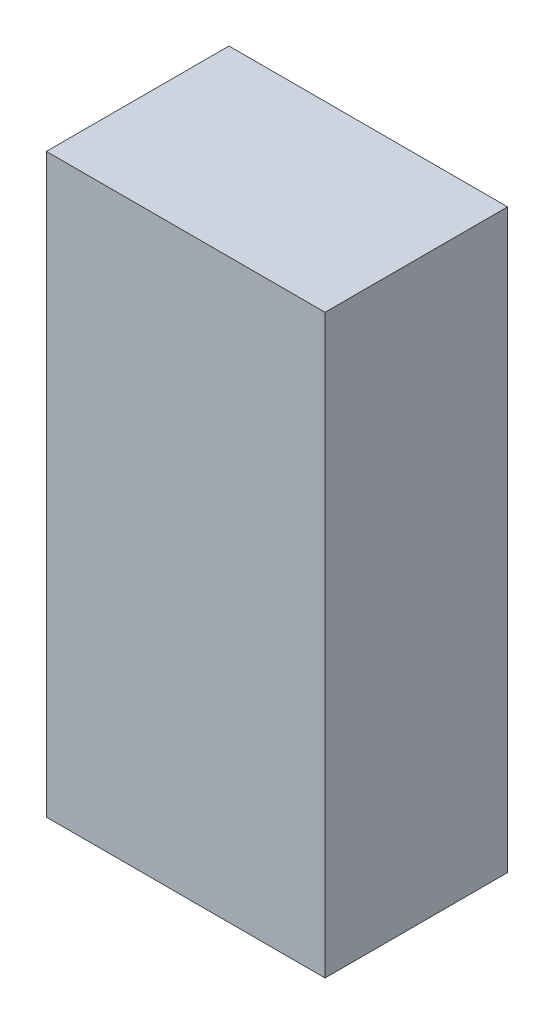
from build123d import *

# Parameters (mm, degrees)
SKETCH1_W      = 368.3
SKETCH1_H      = 241.3
EXTRUDE1_DEPTH = 762


with BuildPart() as part:
    # Sketch1 → Extrude1 (new body)
    with BuildSketch(Plane(origin=(0, 0, 0), x_dir=(1, 0, 0), z_dir=(0, 1, 0))):
        with Locations((184.15, 120.65)):
            Rectangle(SKETCH1_W, SKETCH1_H)
    extrude(amount=EXTRUDE1_DEPTH)


solid = part.part
